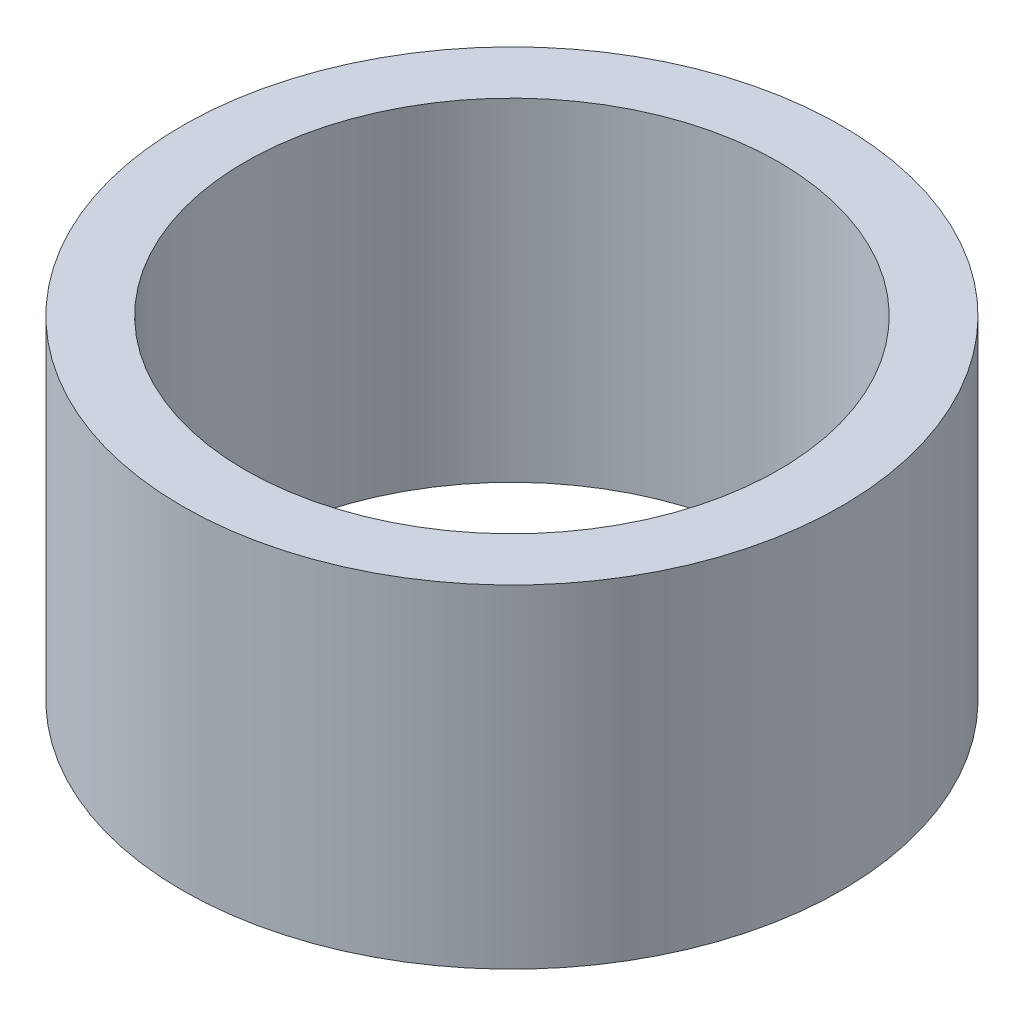
from build123d import *

# Parameters (mm, degrees)
ESQUISSE1_R        = 5.25
ESQUISSE1_R_2      = 4.25
BOSS_EXTRU_1_DEPTH = 5.3


with BuildPart() as part:
    # Esquisse1 → Boss.-Extru.1 (new body)
    with BuildSketch(Plane(origin=(0, 0, 0), x_dir=(1, 0, 0), z_dir=(0, 1, 0))):
        with Locations(Location((0, 0, 0), (0, 0, 270))):
            Circle(ESQUISSE1_R)
        with Locations(Location((0, 0, 0), (0, 0, 270))):
            Circle(ESQUISSE1_R_2, mode=Mode.SUBTRACT)
    extrude(amount=BOSS_EXTRU_1_DEPTH)


solid = part.part
